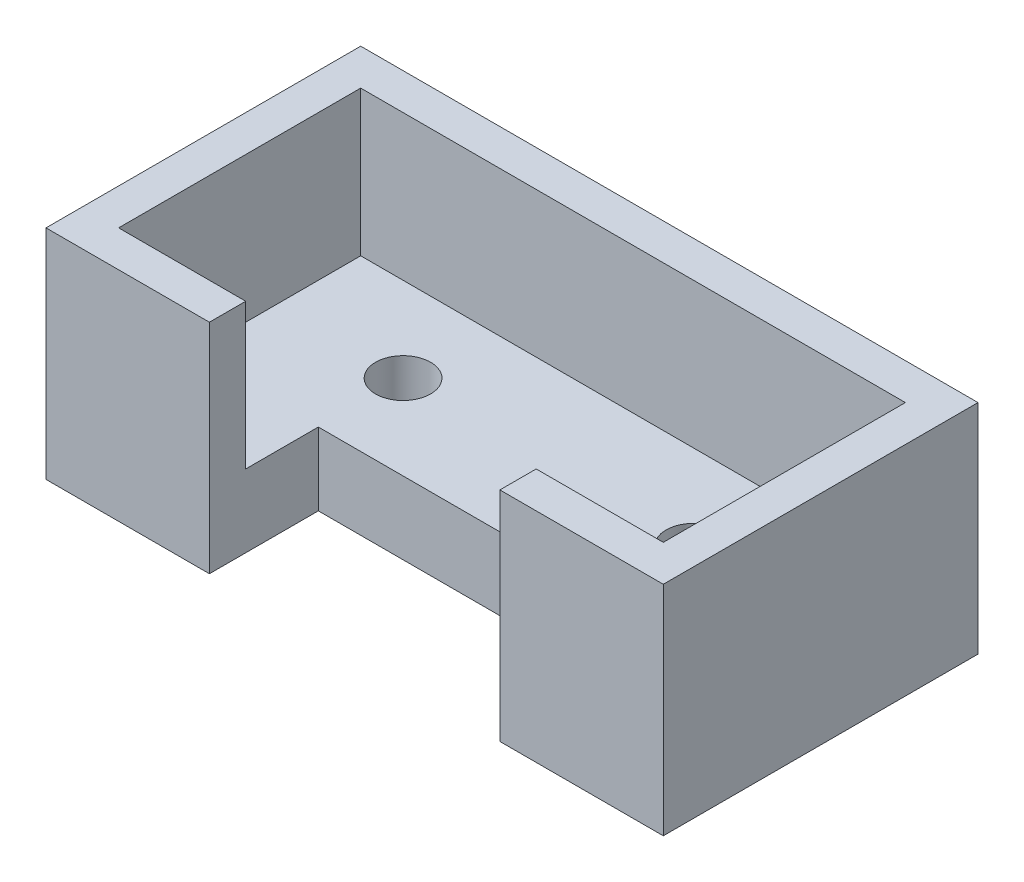
from build123d import *

# Parameters (mm, degrees)
BOSS_EXTRUDE10_DEPTH = 3
SKETCH12_W           = 3
SKETCH12_H           = 12
BOSS_EXTRUDE11_DEPTH = 48
BOSS_EXTRUDE12_REACH = 39.563
SKETCH13_W           = 3
SKETCH13_H           = 12
CUT_EXTRUDE1_DEPTH   = 3
BOSS_EXTRUDE13_DEPTH = 6
CUT_EXTRUDE2_REACH   = 36.536
SKETCH16_R           = 2.2733


with BuildPart() as part:
    # Sketch10 → Boss-Extrude10 (new body)
    with BuildSketch(Plane(origin=(25.395802875, 0, 0), x_dir=(0, 0, -1), z_dir=(1, 0, 0))):
        Polygon((12.569444444, -3.3), (15.569444444, -3.3), (15.569444444, 8.7), (12.569444444, 8.7), (-7.430555556, 8.7), (-10.430555556, 8.7), (-10.430555556, -3.3), (-7.430555556, -3.3), align=None)
    extrude(amount=BOSS_EXTRUDE10_DEPTH)

    # Sketch12 → Boss-Extrude11 (add)
    with BuildSketch(Plane.ZY.offset(-25.395802875)):
        with Locations((-14.069444444, 2.7)):
            Rectangle(SKETCH12_W, SKETCH12_H)
        with Locations((8.930555556, 2.7)):
            Rectangle(SKETCH12_W, SKETCH12_H)
    extrude(amount=BOSS_EXTRUDE11_DEPTH)

    # Sketch13 → Boss-Extrude12 (add, up to next)
    with BuildSketch(Plane.XY.offset(-12.569444444), mode=Mode.PRIVATE) as boss_extrude12_sk1:
        with Locations((-21.104197125, 2.7)):
            Rectangle(SKETCH13_W, SKETCH13_H)
    boss_extrude12_tool1 = extrude(boss_extrude12_sk1.sketch, amount=BOSS_EXTRUDE12_REACH, mode=Mode.PRIVATE) - part.part
    add(boss_extrude12_tool1.solids().sort_by_distance((-21.104197, 2.7, -12.569444))[0])

    # Sketch14 → Cut-Extrude1 (cut)
    with BuildSketch(Plane.XY.offset(10.430555556)):
        Polygon((2.895802875, 8.7), (14.895802875, 8.7), (14.895802875, -3.3), (-9.104197125, -3.3), (-9.104197125, 8.7), align=None)
    extrude(amount=-CUT_EXTRUDE1_DEPTH, mode=Mode.SUBTRACT)

    # Sketch15 → Boss-Extrude13 (add)
    with BuildSketch(Plane.XZ.offset(3.3)):
        Polygon((-22.604197125, 10.430555556), (-22.604197125, -15.569444444), (28.395802875, -15.569444444), (28.395802875, 10.430555556), (14.895802875, 10.430555556), (14.895802875, 7.430555556), (14.895802875, 1.430555556), (-9.104197125, 1.430555556), (-9.104197125, 7.430555556), (-9.104197125, 10.430555556), align=None)
    extrude(amount=BOSS_EXTRUDE13_DEPTH)

    # Sketch16 → Cut-Extrude2 (cut, up to next)
    with BuildSketch(Plane(origin=(0, -3.3, 0), x_dir=(1, 0, 0), z_dir=(0, 1, 0)), mode=Mode.PRIVATE) as cut_extrude2_sk1:
        with Locations(Location((-9.104197125, 5.569444444, 0), (0, 0, 270))):
            Circle(SKETCH16_R)
    cut_extrude2_tool1 = extrude(cut_extrude2_sk1.sketch, amount=-CUT_EXTRUDE2_REACH, mode=Mode.PRIVATE) & part.part
    # Sketch16 → Cut-Extrude2 (cut, up to next)
    with BuildSketch(Plane(origin=(0, -3.3, 0), x_dir=(1, 0, 0), z_dir=(0, 1, 0)), mode=Mode.PRIVATE) as cut_extrude2_sk2:
        with Locations(Location((14.895802875, 5.569444444, 0), (0, 0, 270))):
            Circle(SKETCH16_R)
    cut_extrude2_tool2 = extrude(cut_extrude2_sk2.sketch, amount=-CUT_EXTRUDE2_REACH, mode=Mode.PRIVATE) & part.part
    add(cut_extrude2_tool1.solids().sort_by_distance((-9.104197, -3.3, -5.569444))[0], mode=Mode.SUBTRACT)
    add(cut_extrude2_tool2.solids().sort_by_distance((14.895803, -3.3, -5.569444))[0], mode=Mode.SUBTRACT)


solid = part.part
